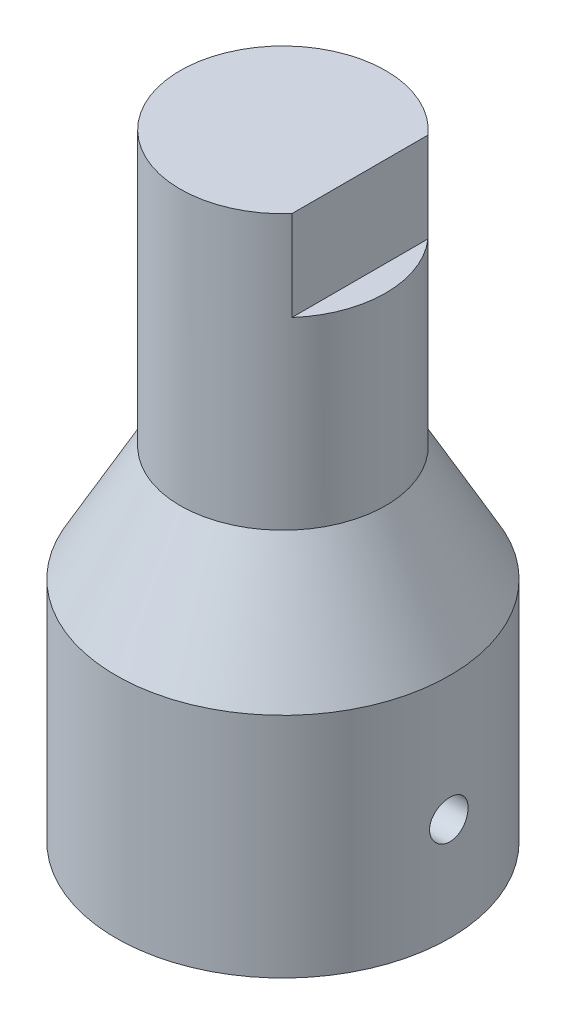
from build123d import *

# Parameters (mm, degrees)
SKETCH2_OUTSIDE_W       = 32.24
SKETCH2_OUTSIDE_H       = 32.24
CUT_EXTRUDE2_DEPTH      = 5.56
SKETCH3_R               = 4.765
CUT_EXTRUDE3_DEPTH      = 14.6
CUT_EXTRUDE4_DEPTH      = 41.799691175
CUT_EXTRUDE4_DEPTH_BACK = 41.799691175
SKETCH4_R               = 1.19


with BuildPart() as part:
    # Sketch1 → Revolve1 (revolve)
    with BuildSketch(Plane.XY, mode=Mode.PRIVATE) as revolve1_sk:
        Polygon((0, 0), (0, 38.1), (6.35, 38.1), (6.35, 21.16), (10.32, 14.06), (10.32, 0), align=None)
    revolve(revolve1_sk.sketch.rotate(Axis((0, 0, 0), (0, 1, 0)), 90), axis=Axis((0, 0, 0), (0, 1, 0)))

    # Sketch2 outside → Cut-Extrude2 (cut)
    with BuildSketch(Plane(origin=(0, 38.1, 0), x_dir=(1, 0, 0), z_dir=(0, 1, 0))):
        Rectangle(SKETCH2_OUTSIDE_W, SKETCH2_OUTSIDE_H)
        with BuildLine():
            Line((4.76, 4.20296324), (4.76, -4.20296324))
            ThreePointArc((4.76, -4.20296324), (-6.35, 0), (4.76, 4.20296324))
        make_face(mode=Mode.SUBTRACT)
    extrude(amount=-CUT_EXTRUDE2_DEPTH, mode=Mode.SUBTRACT)

    # Sketch3 → Cut-Extrude3 (cut)
    with BuildSketch(Plane.XZ):
        with Locations(Location((0, 0, 0), (0, 0, 270))):
            Circle(SKETCH3_R)
    extrude(amount=-CUT_EXTRUDE3_DEPTH, mode=Mode.SUBTRACT)

    # Sketch4 → Cut-Extrude4 (cut, two sides: drawn at the far end of the back side and taken through both)
    with BuildSketch(Plane(origin=(0, 0, 0), x_dir=(0, 0, -1), z_dir=(1, 0, 0)).offset(-CUT_EXTRUDE4_DEPTH_BACK)):
        with Locations((0, 6.35)):
            Circle(SKETCH4_R)
    extrude(amount=CUT_EXTRUDE4_DEPTH + CUT_EXTRUDE4_DEPTH_BACK, mode=Mode.SUBTRACT)


solid = part.part
